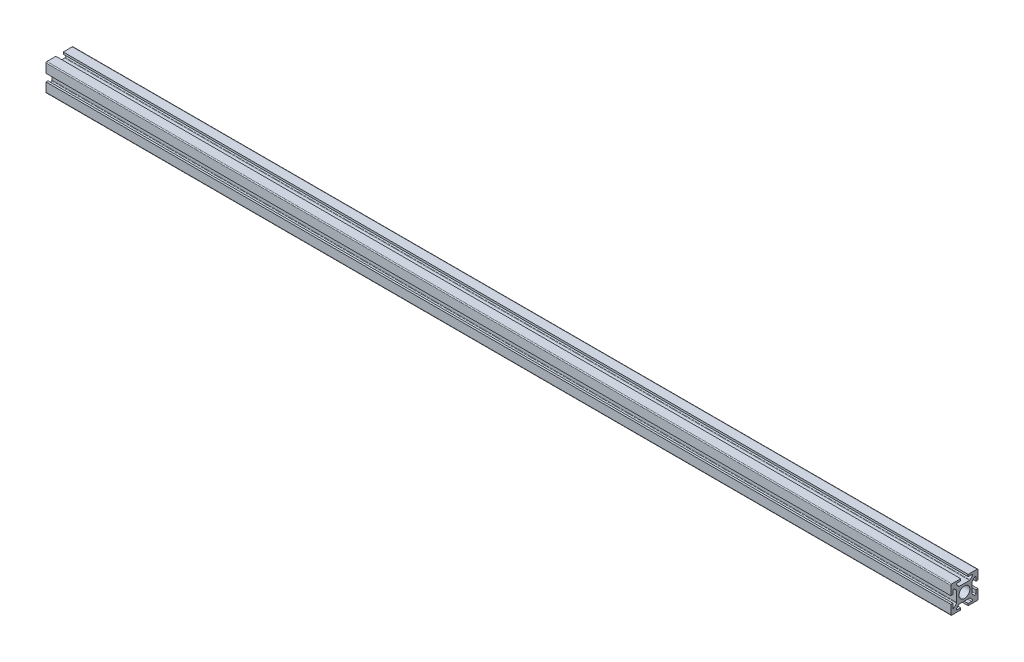
from build123d import *

# Parameters (mm, degrees)
BOSS_EXTRUDE2_DEPTH = 500
FILLET1_R           = 1
SKETCH2_R           = 6
CUT_EXTRUDE1_DEPTH  = 1001.224974693


with BuildPart() as part:
    # Sketch1 → Boss-Extrude2 (new, symmetric)
    with BuildSketch(Plane(origin=(0, 0, 0), x_dir=(0, 0, -1), z_dir=(1, 0, 0))):
        Polygon((-10.3, 12.8), (-6, 8.5), (6, 8.5), (10.3, 12.8), (4.1, 12.8), (4.1, 15), (15, 15), (15, 4.1), (12.8, 4.1), (12.8, 10.3), (8.5, 6), (8.5, -6), (12.8, -10.3), (12.8, -4.1), (15, -4.1), (15, -15), (4.1, -15), (4.1, -12.8), (10.3, -12.8), (6, -8.5), (-6, -8.5), (-10.3, -12.8), (-4.1, -12.8), (-4.1, -15), (-15, -15), (-15, -4.1), (-12.8, -4.1), (-12.8, -10.3), (-8.5, -6), (-8.5, 6), (-12.8, 10.3), (-12.8, 4.1), (-15, 4.1), (-15, 15), (-4.1, 15), (-4.1, 12.8), align=None)
    extrude(amount=BOSS_EXTRUDE2_DEPTH, both=True)

    # Fillet1
    fillet1_edges = [part.edges().sort_by_distance(p)[0] for p in [
        (0, 10.3, 12.8),
        (0, 6, 8.5),
        (0, -6, 8.5),
        (0, -15, 15),
        (0, -12.8, 10.3),
        (0, -8.5, -6),
        (0, -12.8, -10.3),
        (0, -15, -15),
        (0, -10.3, -12.8),
        (0, -6, -8.5),
        (0, 6, -8.5),
        (0, 10.3, -12.8),
        (0, 15, -15),
        (0, 12.8, -10.3),
        (0, 8.5, -6),
        (0, 8.5, 6),
        (0, 12.8, 10.3),
        (0, 15, 15),
    ]]
    fillet(fillet1_edges, radius=FILLET1_R)

    # Sketch2 → Cut-Extrude1 (cut, through all)
    with BuildSketch(Plane.ZY.offset(500)):
        Circle(SKETCH2_R)
    extrude(amount=-CUT_EXTRUDE1_DEPTH, mode=Mode.SUBTRACT)


solid = part.part
